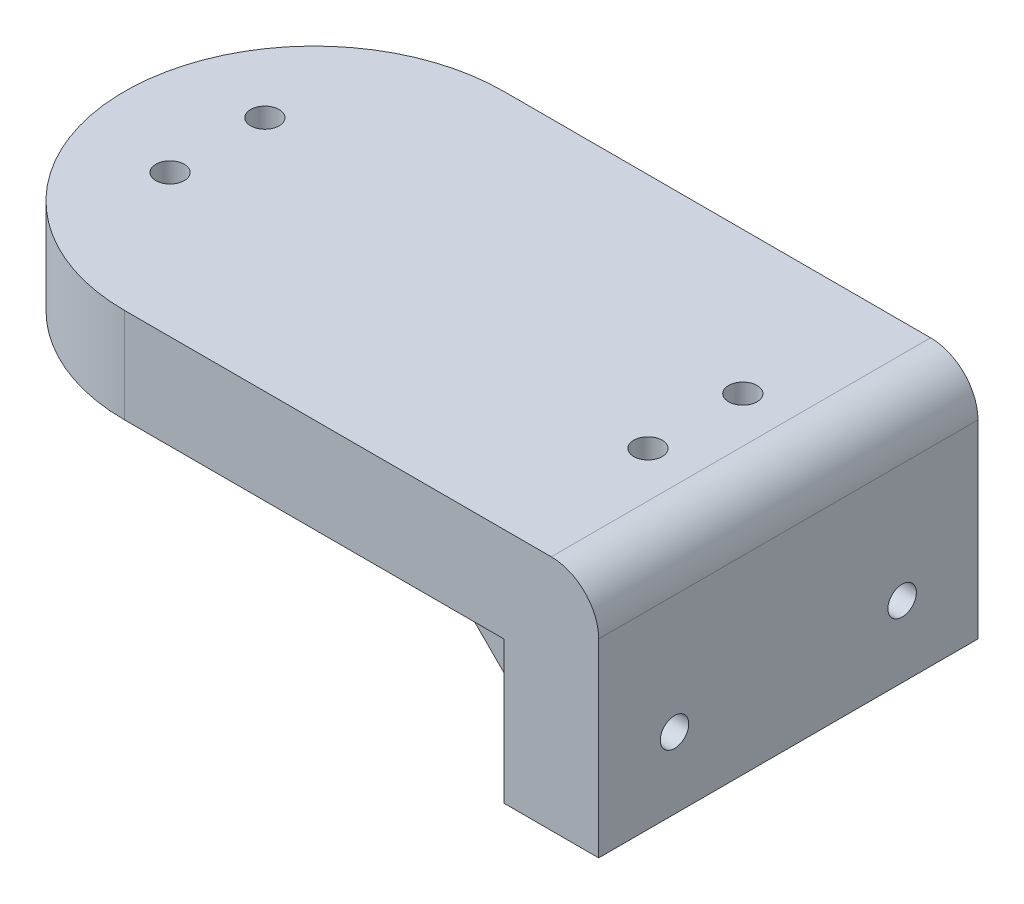
from build123d import *

# Parameters (mm, degrees)
BOSS_EXTRU_1_DEPTH      = 40
ESQUISSE2_R             = 1.5
ENL_V_MAT_EXTRU_1_DEPTH = 40
BOSS_EXTRU_2_START      = -2
BOSS_EXTRU_2_DEPTH      = 2
BOSS_EXTRU_3_START      = -2
BOSS_EXTRU_3_DEPTH      = 2
CONG_1_R                = 5
CONG_2_R                = 3
CONG_3_RADIUS           = 20
CONG_3_LENGTH           = 10
ESQUISSE5_R             = 1.5
ENL_V_MAT_EXTRU_2_DEPTH = 83.006097334


with BuildPart() as part:
    # Esquisse1 → Boss.-Extru.1 (new body)
    with BuildSketch(Plane.XY):
        Polygon((0, 0), (70, 0), (70, -25), (60, -25), (60, -10), (0, -10), align=None)
    extrude(amount=BOSS_EXTRU_1_DEPTH)

    # Esquisse2 → Enlèv. mat.-Extru.1 (cut)
    with BuildSketch(Plane.ZY.offset(-60)):
        with Locations((8, -17.5)):
            Circle(ESQUISSE2_R)
        with Locations((32, -17.5)):
            Circle(ESQUISSE2_R)
    extrude(amount=-ENL_V_MAT_EXTRU_1_DEPTH, mode=Mode.SUBTRACT)

    # Esquisse4 → Boss.-Extru.3 (add)
    with BuildSketch(Plane.XY.offset(40).offset(BOSS_EXTRU_3_START)):
        Polygon((60, -10), (52.928932188, -10), (60, -17.071067812), align=None)
    extrude(amount=-BOSS_EXTRU_3_DEPTH)

    # Congé1
    cong_1_edges = [part.edges().sort_by_distance(p)[0] for p in [
        (70, 0, 20),
    ]]
    fillet(cong_1_edges, radius=CONG_1_R)

    # Congé2
    cong_2_edges = [part.edges().sort_by_distance(p)[0] for p in [
        (60, -10, 18),
    ]]
    fillet(cong_2_edges, radius=CONG_2_R)

    # Congé3: full round fillet: the end face becomes a half cylinder, R = half its width
    cong_3_face = Plane((0, -5, 20), x_dir=(0, 1, 0), z_dir=(-1, 0, 0))  # on the end face: x along it, z out of the body
    cong_3_slab = cong_3_face.offset(-CONG_3_RADIUS / 2) * Box(CONG_3_LENGTH, 2 * CONG_3_RADIUS, CONG_3_RADIUS, mode=Mode.PRIVATE)  # the body's end, R deep
    cong_3_round = Plane((20, -5, 20), x_dir=(-1, 0, 0), z_dir=(0, 1, 0)) * Cylinder(CONG_3_RADIUS, CONG_3_LENGTH, mode=Mode.PRIVATE)  # its axis R under the face
    add(cong_3_slab - cong_3_round, mode=Mode.SUBTRACT)

    # Esquisse5 → Enlèv. mat.-Extru.2 (cut, through all)
    with BuildSketch(Plane.XZ.offset(10)):
        with Locations(Location((60.2, 25, 0), (0, 0, 270))):
            Circle(ESQUISSE5_R)
        with Locations(Location((60.2, 15, 0), (0, 0, 270))):
            Circle(ESQUISSE5_R)
        with Locations(Location((9.8, 25, 0), (0, 0, 270))):
            Circle(ESQUISSE5_R)
        with Locations(Location((9.8, 15, 0), (0, 0, 270))):
            Circle(ESQUISSE5_R)
    extrude(amount=-ENL_V_MAT_EXTRU_2_DEPTH, mode=Mode.SUBTRACT)


with BuildPart() as body_2:
    # Esquisse3 → Boss.-Extru.2 (new body)
    with BuildSketch(Plane(origin=(0, 0, 0), x_dir=(-1, 0, 0), z_dir=(0, 0, -1)).offset(BOSS_EXTRU_2_START)):
        Polygon((-60, -10), (-60, -17.071067812), (-52.928932188, -10), align=None)
    extrude(amount=-BOSS_EXTRU_2_DEPTH)


solid = Compound([part.part, body_2.part])
